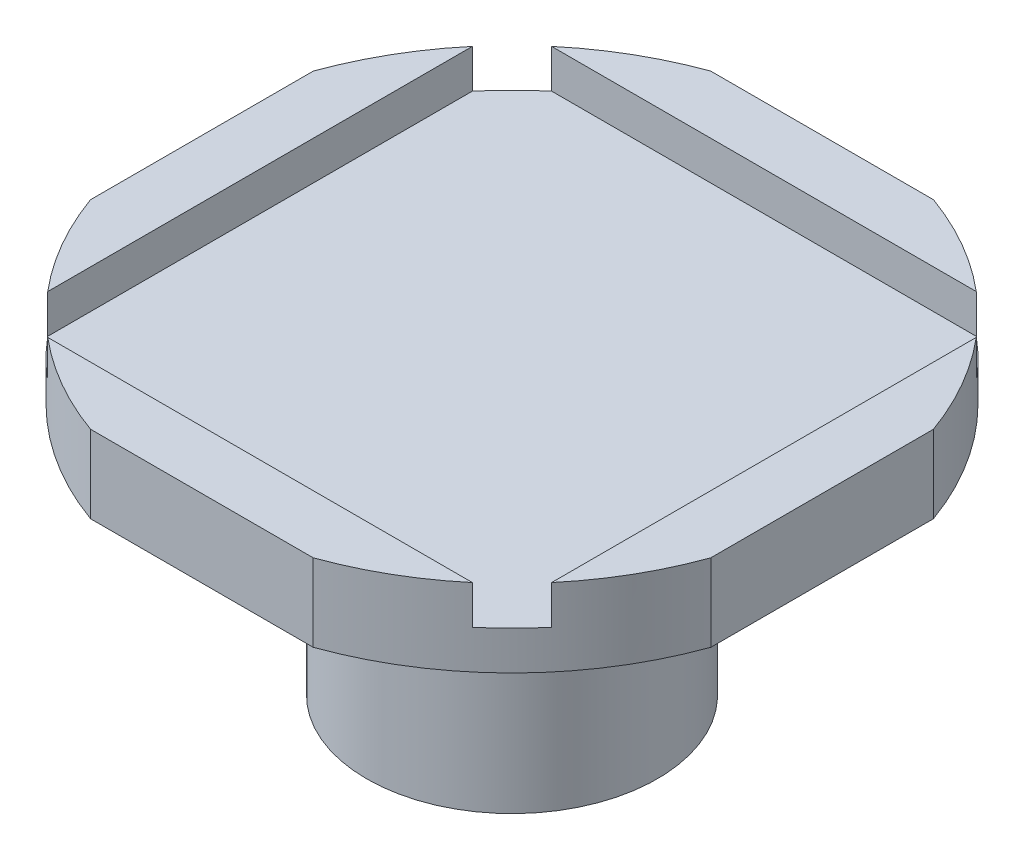
from build123d import *

# Parameters (mm, degrees)
ESQUISSE1_R             = 7.5
BOSS_EXTRU_1_DEPTH      = 12
ESQUISSE2_R             = 8.5
BOSS_EXTRU_2_DEPTH      = 1
ESQUISSE3_W             = 32
ESQUISSE3_H             = 32
ESQUISSE3_W_2           = 26
ESQUISSE3_H_2           = 26
ESQUISSE3_R             = 8.5
BOSS_EXTRU_3_DEPTH      = 2
ESQUISSE4_W             = 32
ESQUISSE4_H             = 32
ESQUISSE4_W_2           = 26
ESQUISSE4_H_2           = 26
BOSS_EXTRU_4_DEPTH      = 2
ESQUISSE6_R             = 32.523409814
ESQUISSE6_R_2           = 17
ENL_V_MAT_EXTRU_1_DEPTH = 29.301943396


with BuildPart() as part:
    # Esquisse1 → Boss.-Extru.1 (new body)
    with BuildSketch(Plane(origin=(0, 0, 0), x_dir=(1, 0, 0), z_dir=(0, 1, 0))):
        with Locations(Location((0, 0, 0), (0, 0, 270))):
            Circle(ESQUISSE1_R)
    extrude(amount=-BOSS_EXTRU_1_DEPTH)

    # Esquisse2 → Boss.-Extru.2 (add)
    with BuildSketch(Plane(origin=(0, 0, 0), x_dir=(1, 0, 0), z_dir=(0, 1, 0))):
        with Locations(Location((0, 0, 0), (0, 0, 270))):
            Circle(ESQUISSE2_R)
    extrude(amount=BOSS_EXTRU_2_DEPTH)


with BuildPart() as body_2:
    # Esquisse3 → Boss.-Extru.3 (new body)
    # profile 1 of 3: a face of its own
    with BuildSketch(Plane(origin=(0, 1, 0), x_dir=(1, 0, 0), z_dir=(0, 1, 0))):
        Rectangle(ESQUISSE3_W, ESQUISSE3_H)
        Rectangle(ESQUISSE3_W_2, ESQUISSE3_H_2, mode=Mode.SUBTRACT)
    # profile 2 of 3: a face of its own
    with BuildSketch(Plane(origin=(0, 1, 0), x_dir=(1, 0, 0), z_dir=(0, 1, 0))):
        Rectangle(ESQUISSE3_W_2, ESQUISSE3_H_2)
        with Locations(Location((0, 0, 0), (0, 0, 270))):
            Circle(ESQUISSE3_R, mode=Mode.SUBTRACT)
    # profile 3 of 3: a face of its own
    with BuildSketch(Plane(origin=(0, 1, 0), x_dir=(1, 0, 0), z_dir=(0, 1, 0))):
        with Locations(Location((0, 0, 0), (0, 0, 270))):
            Circle(ESQUISSE3_R)
    extrude(amount=BOSS_EXTRU_3_DEPTH)

    # Esquisse4 → Boss.-Extru.4 (add)
    with BuildSketch(Plane(origin=(0, 3, 0), x_dir=(1, 0, 0), z_dir=(0, 1, 0))):
        Rectangle(ESQUISSE4_W, ESQUISSE4_H)
        Rectangle(ESQUISSE4_W_2, ESQUISSE4_H_2, mode=Mode.SUBTRACT)
    extrude(amount=BOSS_EXTRU_4_DEPTH)

    # Esquisse6 → Enlèv. mat.-Extru.1 (cut, through all)
    with BuildSketch(Plane(origin=(0, 5, 0), x_dir=(1, 0, 0), z_dir=(0, 1, 0))):
        Circle(ESQUISSE6_R)
        Circle(ESQUISSE6_R_2, mode=Mode.SUBTRACT)
    extrude(amount=-ENL_V_MAT_EXTRU_1_DEPTH, mode=Mode.SUBTRACT)


solid = Compound([part.part, body_2.part])
